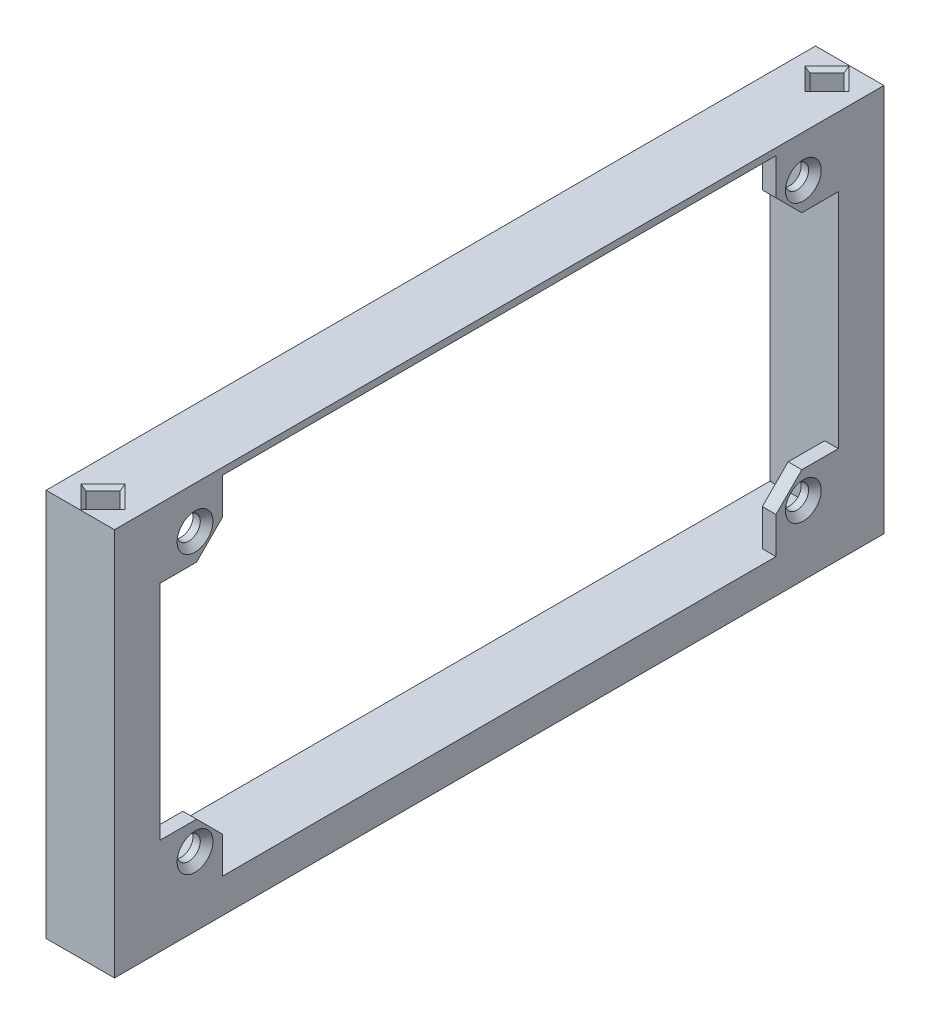
from build123d import *

# Parameters (mm, degrees)
SKETCH1_W                              = 142.9333456
SKETCH1_H                              = 72.120000116
SKETCH1_W_2                            = 126.000012266
SKETCH1_H_2                            = 64.500000116
BOSS_EXTRUDE1_DEPTH                    = 12.7
CUT_EXTRUDE1_DEPTH                     = 5.08
CUT_EXTRUDE2_DEPTH                     = 5.08
CUT_EXTRUDE3_DEPTH                     = 5.08
CHAMFER1_SIZE                          = 0.635
CUT_EXTRUDE4_DEPTH                     = 2.54
F_18_0_1695_DIAMETER_HOLE1_D           = 4.3053
F_18_0_1695_DIAMETER_HOLE1_DEPTH       = 3.81
F_18_0_1695_DIAMETER_HOLE1_CSINK_D     = 5.5753
F_18_0_1695_DIAMETER_HOLE1_CSINK_ANGLE = 90
BOSS_EXTRUDE2_DEPTH                    = 2.54
F_6_CLEARANCE_HOLE1_D                  = 4.3053
F_6_CLEARANCE_HOLE1_CSINK_D            = 6.6548
F_6_CLEARANCE_HOLE1_CSINK_ANGLE        = 90


with BuildPart() as part:
    # Sketch1 → Boss-Extrude1 (new body)
    with BuildSketch(Plane(origin=(0, 0, 0), x_dir=(0, 0, -1), z_dir=(1, 0, 0))):
        with Locations((0, -2.54)):
            Rectangle(SKETCH1_W, SKETCH1_H)
        Rectangle(SKETCH1_W_2, SKETCH1_H_2, mode=Mode.SUBTRACT)
    extrude(amount=-BOSS_EXTRUDE1_DEPTH)

    # Sketch2 → Cut-Extrude1 (cut)
    with BuildSketch(Plane(origin=(0, 33.520000058, 0), x_dir=(1, 0, 0), z_dir=(0, 1, 0))):
        Polygon((-3.175, 67.233339467), (-6.35, 64.058339467), (-9.525, 67.233339467), (-6.35, 70.408339467), align=None)
        Polygon((-3.175, -67.233339467), (-6.35, -70.408339467), (-9.525, -67.233339467), (-6.35, -64.058339467), align=None)
    extrude(amount=-CUT_EXTRUDE1_DEPTH, mode=Mode.SUBTRACT)

    # Sketch3 → Cut-Extrude2 (cut)
    with BuildSketch(Plane.ZY.offset(12.7)):
        Polygon((70.408339467, 25.053333392), (67.233339467, 21.878333392), (64.058339467, 25.053333392), (67.233339467, 28.228333392), align=None)
        Polygon((-64.058339467, -30.133333392), (-67.233339467, -33.308333392), (-70.408339467, -30.133333392), (-67.233339467, -26.958333392), align=None)
        Polygon((64.058339467, -30.133333392), (67.233339467, -26.958333392), (70.408339467, -30.133333392), (67.233339467, -33.308333392), align=None)
    extrude(amount=-CUT_EXTRUDE2_DEPTH, mode=Mode.SUBTRACT)

    # Sketch5 → Cut-Extrude3 (cut)
    with BuildSketch(Plane.XZ.offset(38.600000058)):
        Polygon((-4.233333333, -70.408339467), (-7.408333333, -67.233339467), (-4.233333333, -64.058339467), (-1.058333333, -67.233339467), align=None)
        Polygon((-4.233333333, 64.058339467), (-7.408333333, 67.233339467), (-4.233333333, 70.408339467), (-1.058333333, 67.233339467), align=None)
    extrude(amount=-CUT_EXTRUDE3_DEPTH, mode=Mode.SUBTRACT)

    # Chamfer1
    chamfer1_edges = [part.edges().sort_by_distance(p)[0] for p in [
        (-2.645833333, -33.520000058, -68.820839467),
        (-5.820833333, -33.520000058, -68.820839467),
        (-5.820833333, -33.520000058, -65.645839467),
        (-2.645833333, -33.520000058, -65.645839467),
        (-2.645833333, -38.600000058, -68.820839467),
        (-2.645833333, -38.600000058, -65.645839467),
        (-5.820833333, -38.600000058, -65.645839467),
        (-5.820833333, -38.600000058, -68.820839467),
        (-2.645833333, -33.520000058, 65.645839467),
        (-5.820833333, -33.520000058, 65.645839467),
        (-5.820833333, -33.520000058, 68.820839467),
        (-2.645833333, -33.520000058, 68.820839467),
        (-2.645833333, -38.600000058, 65.645839467),
        (-2.645833333, -38.600000058, 68.820839467),
        (-5.820833333, -38.600000058, 68.820839467),
        (-5.820833333, -38.600000058, 65.645839467),
        (-4.7625, 28.440000058, -68.820839467),
        (-4.7625, 28.440000058, -65.645839467),
        (-7.9375, 28.440000058, -65.645839467),
        (-7.9375, 28.440000058, -68.820839467),
        (-4.7625, 33.520000058, -68.820839467),
        (-7.9375, 33.520000058, -68.820839467),
        (-7.9375, 33.520000058, -65.645839467),
        (-4.7625, 33.520000058, -65.645839467),
        (-4.7625, 28.440000058, 65.645839467),
        (-4.7625, 28.440000058, 68.820839467),
        (-7.9375, 28.440000058, 68.820839467),
        (-7.9375, 28.440000058, 65.645839467),
        (-4.7625, 33.520000058, 65.645839467),
        (-7.9375, 33.520000058, 65.645839467),
        (-7.9375, 33.520000058, 68.820839467),
        (-4.7625, 33.520000058, 68.820839467),
        (-7.62, 26.640833392, 68.820839467),
        (-7.62, 23.465833392, 68.820839467),
        (-7.62, 23.465833392, 65.645839467),
        (-7.62, 26.640833392, 65.645839467),
        (-12.7, 26.640833392, 68.820839467),
        (-12.7, 26.640833392, 65.645839467),
        (-12.7, 23.465833392, 65.645839467),
        (-12.7, 23.465833392, 68.820839467),
        (-7.62, -28.545833392, -65.645839467),
        (-7.62, -31.720833392, -65.645839467),
        (-7.62, -31.720833392, -68.820839467),
        (-7.62, -28.545833392, -68.820839467),
        (-12.7, -28.545833392, -65.645839467),
        (-12.7, -28.545833392, -68.820839467),
        (-12.7, -31.720833392, -68.820839467),
        (-12.7, -31.720833392, -65.645839467),
        (-7.62, -31.720833392, 65.645839467),
        (-7.62, -28.545833392, 65.645839467),
        (-7.62, -28.545833392, 68.820839467),
        (-7.62, -31.720833392, 68.820839467),
        (-12.7, -31.720833392, 65.645839467),
        (-12.7, -31.720833392, 68.820839467),
        (-12.7, -28.545833392, 68.820839467),
        (-12.7, -28.545833392, 65.645839467),
    ]]
    chamfer(chamfer1_edges, length=CHAMFER1_SIZE)

    # Sketch6 → Cut-Extrude4 (cut)
    with BuildSketch(Plane(origin=(0, -32.250000058, 0), x_dir=(1, 0, 0), z_dir=(0, 1, 0))):
        with BuildLine():
            Line((-8.466666582, -55.126006133), (-12.7, -55.126006133))
            Line((-12.7, -55.126006133), (-12.7, -63.000006133))
            Line((-12.7, -63.000006133), (-8.466666582, -63.000006133))
            ThreePointArc((-8.466666582, -63.000006133), (-4.529666582, -59.063006133), (-8.466666582, -55.126006133))
        make_face()
    extrude(amount=-CUT_EXTRUDE4_DEPTH, mode=Mode.SUBTRACT)

    # #18 (0.1695) Diameter Hole1
    with Locations(Plane(origin=(0, -34.790000058, 0), x_dir=(1, 0, 0), z_dir=(0, 1, 0))):
        with Locations((-8.466666582, -59.063006133)):
            CounterSinkHole(F_18_0_1695_DIAMETER_HOLE1_D / 2, F_18_0_1695_DIAMETER_HOLE1_CSINK_D / 2, depth=F_18_0_1695_DIAMETER_HOLE1_DEPTH, counter_sink_angle=F_18_0_1695_DIAMETER_HOLE1_CSINK_ANGLE)

    # Sketch9 → Boss-Extrude2 (add)
    with BuildSketch(Plane(origin=(0, 0, 0), x_dir=(0, 0, -1), z_dir=(1, 0, 0))):
        Polygon((-63.000006133, 20.669993925), (-56.216595593, 20.669993925), (-51.42, 25.466589518), (-51.42, 32.250000058), (-63.000006133, 32.250000058), align=None)
        Polygon((-63.000006133, -20.669993925), (-56.216595593, -20.669993925), (-51.42, -25.466589518), (-51.42, -32.250000058), (-63.000006133, -32.250000058), align=None)
        Polygon((51.42, -32.250000058), (51.42, -25.466589518), (56.216595593, -20.669993925), (63.000006133, -20.669993925), (63.000006133, -32.250000058), align=None)
        Polygon((51.42, 32.250000058), (51.42, 25.466589518), (56.216595593, 20.669993925), (63.000006133, 20.669993925), (63.000006133, 32.250000058), align=None)
    extrude(amount=-BOSS_EXTRUDE2_DEPTH)

    # #6 Clearance Hole1 (through all)
    with Locations(Plane(origin=(0, 0, 0), x_dir=(0, 0, -1), z_dir=(1, 0, 0))):
        with Locations((-56.5, 25.75), (56.5, 25.75), (56.5, -25.75), (-56.5, -25.75)):
            CounterSinkHole(F_6_CLEARANCE_HOLE1_D / 2, F_6_CLEARANCE_HOLE1_CSINK_D / 2, counter_sink_angle=F_6_CLEARANCE_HOLE1_CSINK_ANGLE)


solid = part.part
